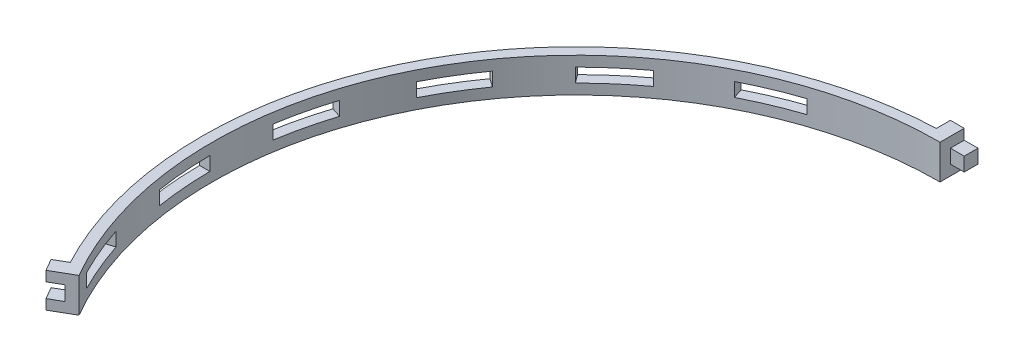
from build123d import *

# Parameters (mm, degrees)
BOSS_EXTRUDE1_DEPTH             = 10
SKETCH2_W                       = 8
SKETCH2_H                       = 4.2
CUT_EXTRUDE1_DEPTH              = 4
SKETCH3_W                       = 8
SKETCH3_H                       = 4
BOSS_EXTRUDE2_DEPTH             = 4
SKETCH4_W                       = 16
SKETCH4_H                       = 4
CUT_EXTRUDE2_DEPTH              = 157.615771875
CIRPATTERN4_COUNT               = 5
CIRPATTERN4_ANGLE               = 72
CIRPATTERN4_THE_OTHER_WAY_COUNT = 5
CIRPATTERN4_THE_OTHER_WAY_ANGLE = 72


with BuildPart() as part:
    # Sketch1 → Boss-Extrude1 (new body)
    with BuildSketch(Plane(origin=(0, 0, 0), x_dir=(1, 0, 0), z_dir=(0, 1, 0))):
        with BuildLine():
            Line((-4, 112.5), (-4, 108.426242211))
            ThreePointArc((-4, 108.426242211), (-93.963756311, 54.25), (-95.899880192, -50.74901949))
            Line((-95.899880192, -50.74901949), (-99.427857926, -52.785898385))
            Line((-99.427857926, -52.785898385), (-97.427857926, -56.25))
            Line((-97.427857926, -56.25), (-91.365680099, -52.75))
            ThreePointArc((-91.365680099, -52.75), (-91.365680099, 52.75), (0, 105.5))
            Line((0, 105.5), (0, 112.5))
            Line((0, 112.5), (-4, 112.5))
        make_face()
    extrude(amount=BOSS_EXTRUDE1_DEPTH)

    # Sketch2 → Cut-Extrude1 (cut)
    with BuildSketch(Plane(origin=(-97.427857926, 0, 56.25), x_dir=(0.4999999999999976, 0, 0.86602540378444), z_dir=(-0.8660254037844402, 0, 0.4999999999999977))):
        with Locations((0, 5)):
            Rectangle(SKETCH2_W, SKETCH2_H)
    extrude(amount=-CUT_EXTRUDE1_DEPTH, mode=Mode.SUBTRACT)

    # Sketch3 → Boss-Extrude2 (add)
    with BuildSketch(Plane(origin=(0, 0, -112.5), x_dir=(-1, 0, 0), z_dir=(0, 0, -1))):
        with Locations((0, 5)):
            Rectangle(SKETCH3_W, SKETCH3_H)
    extrude(amount=-BOSS_EXTRUDE2_DEPTH)

    # Sketch4 → Cut-Extrude2 (cut, through all)
    with BuildSketch(Plane(origin=(0, 0, 0), x_dir=(0, 0, -1), z_dir=(1, 0, 0))):
        with Locations((-8.672320837, 5)):
            Rectangle(SKETCH4_W, SKETCH4_H)
    cut_extrude2 = extrude(amount=-CUT_EXTRUDE2_DEPTH, mode=Mode.SUBTRACT)

    # CirPattern4: Cut-Extrude2 ×5 about axis
    cirpattern4_axis = Axis((0, 0, 0), (0, -1, 0))
    for i in range(1, CIRPATTERN4_COUNT):
        add(cut_extrude2.rotate(cirpattern4_axis, i * CIRPATTERN4_ANGLE / (CIRPATTERN4_COUNT - 1)), mode=Mode.SUBTRACT)

    # CirPattern4 the other way: Cut-Extrude2 ×5 about axis
    cirpattern4_the_other_way_axis = Axis((0, 0, 0), (0, 1, 0))
    for i in range(1, CIRPATTERN4_THE_OTHER_WAY_COUNT):
        add(cut_extrude2.rotate(cirpattern4_the_other_way_axis, i * CIRPATTERN4_THE_OTHER_WAY_ANGLE / (CIRPATTERN4_THE_OTHER_WAY_COUNT - 1)), mode=Mode.SUBTRACT)


solid = part.part
